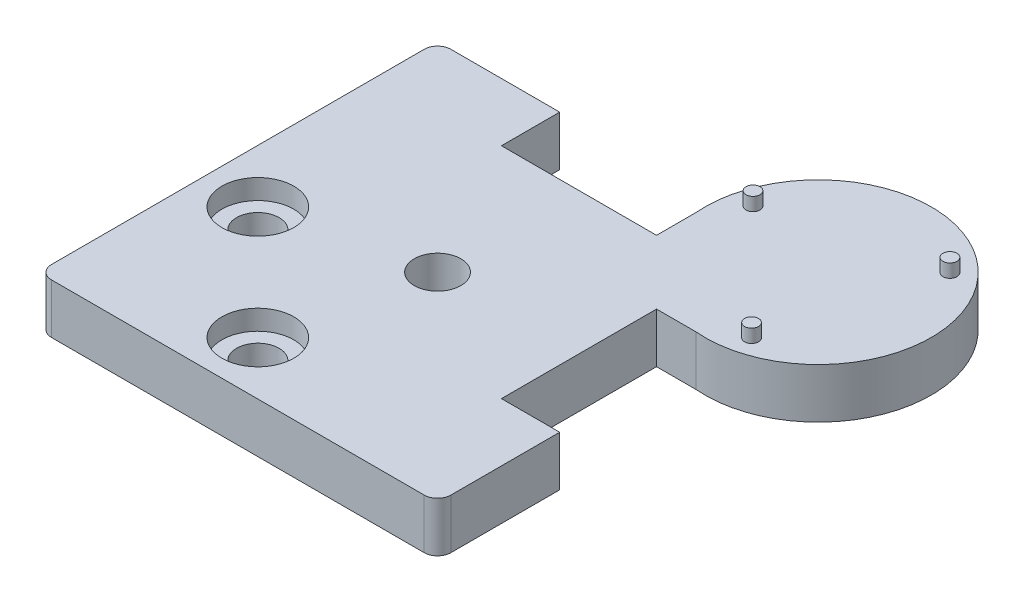
from build123d import *

# Parameters (mm, degrees)
SKETCH1_W                    = 76.2
SKETCH1_H                    = 76.2
BOSS_EXTRUDE1_DEPTH          = 9.525
SKETCH6_R                    = 3.81
CUT_EXTRUDE2_DEPTH           = 2.54
CUT_EXTRUDE2_DRAFT           = 30
CUT_EXTRUDE2_PROFILE_2_DEPTH = 2.54
CUT_EXTRUDE2_PROFILE_2_DRAFT = 30
CUT_EXTRUDE4_REACH           = 56.717
SKETCH12_R                   = 4.064
SKETCH13_R                   = 6.858
CUT_EXTRUDE7_DEPTH           = 3.81
SKETCH7_R                    = 4.445
CUT_EXTRUDE8_DEPTH           = 3.81
CUT_EXTRUDE8_TAPER           = 45
CUT_EXTRUDE9_REACH           = 56.717
SKETCH15_R                   = 4.445
FILLET1_R                    = 2.54
CUT_EXTRUDE10_REACH          = 56.717
SKETCH16_W                   = 29.591
SKETCH16_H                   = 11.1125
SKETCH16_W_2                 = 11.1125
SKETCH16_H_2                 = 29.591
SKETCH17_R                   = 21.59
BOSS_EXTRUDE2_DEPTH          = 9.525
SKETCH18_R                   = 1.3335
BOSS_EXTRUDE3_DEPTH          = 2.54


with BuildPart() as part:
    # Sketch1 → Boss-Extrude1 (new body)
    with BuildSketch(Plane(origin=(0, 0, 0), x_dir=(1, 0, 0), z_dir=(0, 1, 0))):
        Rectangle(SKETCH1_W, SKETCH1_H)
    extrude(amount=BOSS_EXTRUDE1_DEPTH)


with BuildPart() as cut_extrude2_tool:
    # Sketch6 → Cut-Extrude2 (with draft: the straight prism first)
    with BuildSketch(Plane(origin=(0, 0, 0), x_dir=(1, 0, 0), z_dir=(0, 1, 0))):
        with Locations((-28.575, 28.575)):
            Circle(SKETCH6_R)
    extrude(amount=CUT_EXTRUDE2_DEPTH)
    # Cut-Extrude2: the draft: its side faces are tilted about the plane it starts from
    cut_extrude2_sides = [cut_extrude2_tool.faces().sort_by_distance(p)[0] for p in [
        (-32.385, 1.27, -28.575),
    ]]
    draft(cut_extrude2_sides, Plane(origin=(0, 0, 0), x_dir=(1, 0, 0), z_dir=(0, 1, 0)), CUT_EXTRUDE2_DRAFT)


with BuildPart() as part_1:
    add(part.part)

    # Cut-Extrude2: cut by cut_extrude2_tool
    add(cut_extrude2_tool.part, mode=Mode.SUBTRACT)


with BuildPart() as cut_extrude2_profile_2_tool:
    # Sketch6 → Cut-Extrude2 profile 2 (with draft: the straight prism first)
    with BuildSketch(Plane(origin=(0, 0, 0), x_dir=(1, 0, 0), z_dir=(0, 1, 0))):
        with Locations((28.575, -28.575)):
            Circle(SKETCH6_R)
    extrude(amount=CUT_EXTRUDE2_PROFILE_2_DEPTH)
    # Cut-Extrude2 profile 2: the draft: its side faces are tilted about the plane it starts from
    cut_extrude2_profile_2_sides = [cut_extrude2_profile_2_tool.faces().sort_by_distance(p)[0] for p in [
        (24.765, 1.27, 28.575),
    ]]
    draft(cut_extrude2_profile_2_sides, Plane(origin=(0, 0, 0), x_dir=(1, 0, 0), z_dir=(0, 1, 0)), CUT_EXTRUDE2_PROFILE_2_DRAFT)


with BuildPart() as part_2:
    add(part_1.part)

    # Cut-Extrude2 profile 2: cut by cut_extrude2_profile_2_tool
    add(cut_extrude2_profile_2_tool.part, mode=Mode.SUBTRACT)

    # Sketch12 → Cut-Extrude4 (cut, up to next)
    with BuildSketch(Plane(origin=(0, 9.525, 0), x_dir=(1, 0, 0), z_dir=(0, 1, 0)), mode=Mode.PRIVATE) as cut_extrude4_sk1:
        with Locations(Location((-27.94, -6.35, 0), (0, 0, 270))):
            Circle(SKETCH12_R)
    cut_extrude4_tool1 = extrude(cut_extrude4_sk1.sketch, amount=-CUT_EXTRUDE4_REACH, mode=Mode.PRIVATE) & part_2.part
    # Sketch12 → Cut-Extrude4 (cut, up to next)
    with BuildSketch(Plane(origin=(0, 9.525, 0), x_dir=(1, 0, 0), z_dir=(0, 1, 0)), mode=Mode.PRIVATE) as cut_extrude4_sk2:
        with Locations(Location((-6.35, -27.94, 0), (0, 0, 270))):
            Circle(SKETCH12_R)
    cut_extrude4_tool2 = extrude(cut_extrude4_sk2.sketch, amount=-CUT_EXTRUDE4_REACH, mode=Mode.PRIVATE) & part_2.part
    add(cut_extrude4_tool1.solids().sort_by_distance((-27.94, 9.525, 6.35))[0], mode=Mode.SUBTRACT)
    add(cut_extrude4_tool2.solids().sort_by_distance((-6.35, 9.525, 27.94))[0], mode=Mode.SUBTRACT)

    # Sketch13 → Cut-Extrude7 (cut)
    with BuildSketch(Plane.XZ.offset(-9.525)):
        with Locations(Location((-27.94, 6.35, 0), (0, 0, 90))):
            Circle(SKETCH13_R)
        with Locations(Location((-6.35, 27.94, 0), (0, 0, 90))):
            Circle(SKETCH13_R)
    extrude(amount=CUT_EXTRUDE7_DEPTH, mode=Mode.SUBTRACT)

    # Sketch7 → Cut-Extrude8 (cut)
    with BuildSketch(Plane(origin=(0, 0, 0), x_dir=(1, 0, 0), z_dir=(0, 1, 0))):
        with Locations((-27.94, -27.94)):
            Circle(SKETCH7_R)
    extrude(amount=CUT_EXTRUDE8_DEPTH, taper=CUT_EXTRUDE8_TAPER, mode=Mode.SUBTRACT)

    # Sketch15 → Cut-Extrude9 (cut, up to next)
    with BuildSketch(Plane(origin=(0, 9.525, 0), x_dir=(1, 0, 0), z_dir=(0, 1, 0)), mode=Mode.PRIVATE) as cut_extrude9_sk1:
        with Locations(Location((0, 0, 0), (0, 0, 270))):
            Circle(SKETCH15_R)
    cut_extrude9_tool1 = extrude(cut_extrude9_sk1.sketch, amount=-CUT_EXTRUDE9_REACH, mode=Mode.PRIVATE) & part_2.part
    add(cut_extrude9_tool1.solids().sort_by_distance((0, 9.525, 0))[0], mode=Mode.SUBTRACT)

    # Fillet1
    fillet1_edges = [part_2.edges().sort_by_distance(p)[0] for p in [
        (38.1, 4.7625, 38.1),
        (-38.1, 4.7625, 38.1),
        (-38.1, 4.7625, -38.1),
        (38.1, 4.7625, -38.1),
    ]]
    fillet(fillet1_edges, radius=FILLET1_R)

    # Sketch16 → Cut-Extrude10 (cut, up to next)
    with BuildSketch(Plane.XZ, mode=Mode.PRIVATE) as cut_extrude10_sk1:
        with Locations((0, -32.54375)):
            Rectangle(SKETCH16_W, SKETCH16_H)
    cut_extrude10_tool1 = extrude(cut_extrude10_sk1.sketch, amount=-CUT_EXTRUDE10_REACH, mode=Mode.PRIVATE) & part_2.part
    # Sketch16 → Cut-Extrude10 (cut, up to next)
    with BuildSketch(Plane.XZ, mode=Mode.PRIVATE) as cut_extrude10_sk2:
        with Locations((32.54375, 0)):
            Rectangle(SKETCH16_W_2, SKETCH16_H_2)
    cut_extrude10_tool2 = extrude(cut_extrude10_sk2.sketch, amount=-CUT_EXTRUDE10_REACH, mode=Mode.PRIVATE) & part_2.part
    add(cut_extrude10_tool1.solids().sort_by_distance((0, 0, -32.54375))[0], mode=Mode.SUBTRACT)
    add(cut_extrude10_tool2.solids().sort_by_distance((32.54375, 0, 0))[0], mode=Mode.SUBTRACT)

    # Sketch17 → Boss-Extrude2 (add)
    with BuildSketch(Plane(origin=(0, 9.525, 0), x_dir=(1, 0, 0), z_dir=(0, 1, 0))):
        with Locations((36.311274722, 36.311274722)):
            Circle(SKETCH17_R)
    extrude(amount=-BOSS_EXTRUDE2_DEPTH)

    # Sketch18 → Boss-Extrude3 (add)
    with BuildSketch(Plane(origin=(0, 9.525, 0), x_dir=(1, 0, 0), z_dir=(0, 1, 0))):
        with Locations(Location((19.166305808, 41.020673934, 0), (0, 0, 270))):
            Circle(SKETCH18_R)
        with Locations(Location((48.962218533, 48.804553742, 0), (0, 0, 270))):
            Circle(SKETCH18_R)
        with Locations(Location((40.805299824, 19.108596489, 0), (0, 0, 270))):
            Circle(SKETCH18_R)
    extrude(amount=BOSS_EXTRUDE3_DEPTH)


solid = part_2.part
